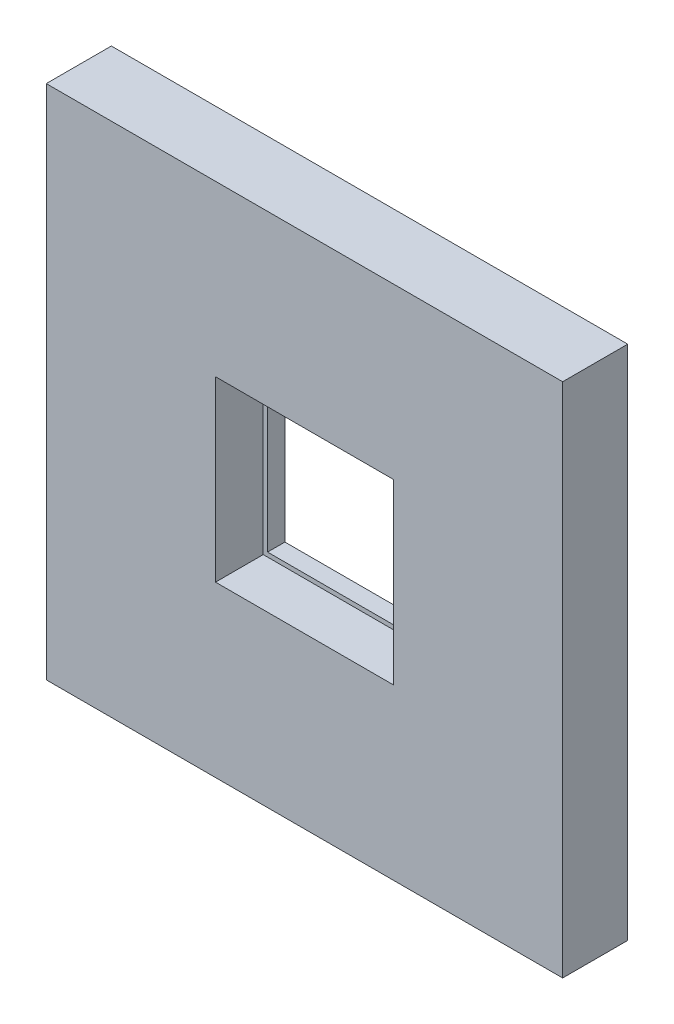
from build123d import *

# Parameters (mm, degrees)
SKETCH1_W           = 11.9
SKETCH1_H           = 11.9
SKETCH1_W_2         = 4.1
SKETCH1_H_2         = 4.1
BOSS_EXTRUDE1_DEPTH = 1.5
SKETCH1_6_W         = 4.1
SKETCH1_6_H         = 4.1
SKETCH1_6_W_2       = 3.9
SKETCH1_6_H_2       = 3.9
BOSS_EXTRUDE2_DEPTH = 0.4


with BuildPart() as part:
    # Sketch1 → Boss-Extrude1 (new body)
    with BuildSketch(Plane.XY):
        Rectangle(SKETCH1_W, SKETCH1_H)
        Rectangle(SKETCH1_W_2, SKETCH1_H_2, mode=Mode.SUBTRACT)
    extrude(amount=BOSS_EXTRUDE1_DEPTH)


with BuildPart() as body_2:
    # Sketch1<6> → Boss-Extrude2 (new body)
    with BuildSketch(Plane.XY):
        Rectangle(SKETCH1_6_W, SKETCH1_6_H)
        Rectangle(SKETCH1_6_W_2, SKETCH1_6_H_2, mode=Mode.SUBTRACT)
    extrude(amount=BOSS_EXTRUDE2_DEPTH)


solid = Compound([part.part, body_2.part])
